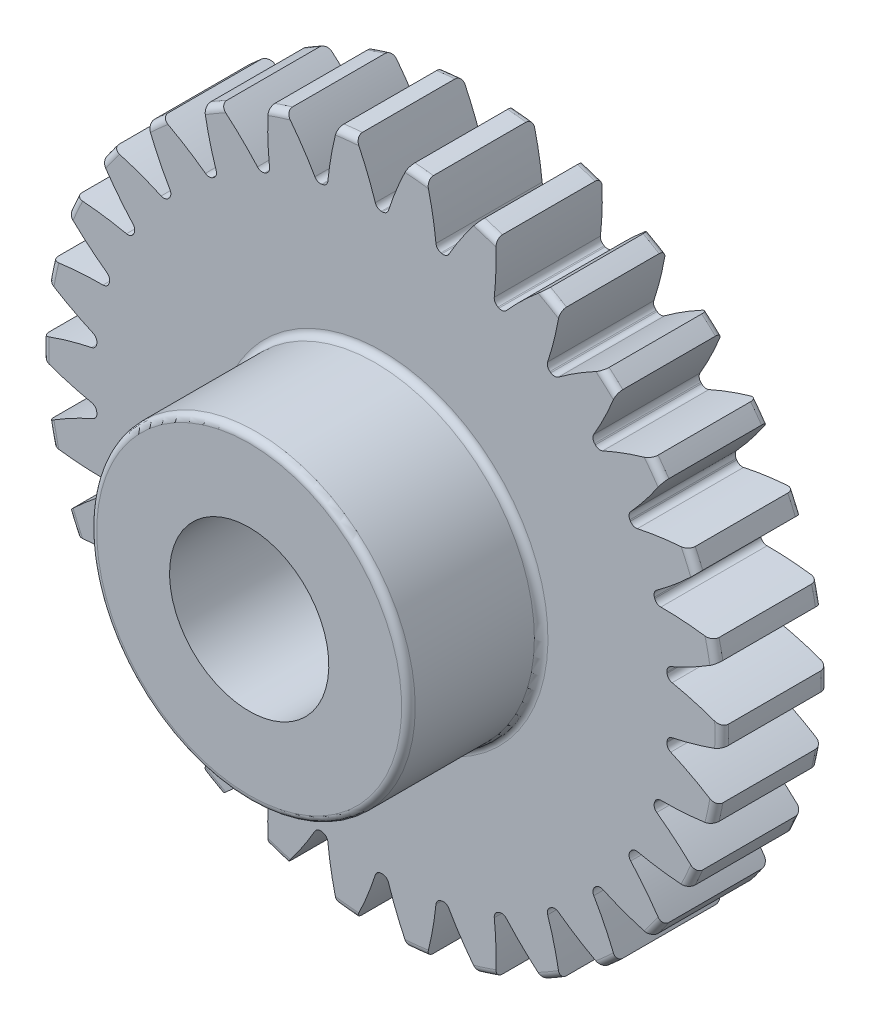
from build123d import *

# Parameters (mm, degrees)
FILLET2_R          = 0.256
CUT_EXTRUDE2_DEPTH = 19.779776425
CIRPATTERN1_COUNT  = 30


with BuildPart() as part:
    # Sketch4 → Revolve1 (revolve)
    with BuildSketch(Plane(origin=(0, 0, 0), x_dir=(0, 0, -1), z_dir=(1, 0, 0))):
        Polygon((-9, 3), (-9, 6), (-4, 6), (-4, 12.8), (0, 12.8), (0, 3), align=None)
    revolve(axis=Axis((0, 0, 4), (0, 0, 1)))

    # Fillet2
    fillet2_edges = [part.edges().sort_by_distance(p)[0] for p in [
        (0, -12.8, 0),
        (0, -12.8, 4),
        (0, -6, 4),
        (0, -6, 9),
    ]]
    fillet(fillet2_edges, radius=FILLET2_R)

    # Sketch7 → Cut-Extrude2 (cut, through all)
    with BuildSketch(Plane.XY.offset(4)):
        with BuildLine():
            ThreePointArc((-0.020673836, 10.799980213), (0, 10.8), (0.020673836, 10.799980213))
            ThreePointArc((0.020673836, 10.799980213), (0.162335885, 10.845909085), (0.249638935, 10.966556401))
            ThreePointArc((0.249638935, 10.966556401), (0.584265018, 11.879080172), (0.991642986, 12.761529853))
            ThreePointArc((0.991642986, 12.761529853), (0, 12.8), (-0.991642986, 12.761529853))
            ThreePointArc((-0.991642986, 12.761529853), (-0.584265018, 11.879080172), (-0.249638935, 10.966556401))
            ThreePointArc((-0.249638935, 10.966556401), (-0.162335885, 10.845909085), (-0.020673836, 10.799980213))
        make_face()
    cut_extrude2 = extrude(amount=-CUT_EXTRUDE2_DEPTH, mode=Mode.SUBTRACT)

    # CirPattern1: Cut-Extrude2 ×30 about axis
    cirpattern1_axis = Axis((0, 0, 0), (0, 0, 1))
    for i in range(1, CIRPATTERN1_COUNT):
        add(cut_extrude2.rotate(cirpattern1_axis, i * 360 / CIRPATTERN1_COUNT), mode=Mode.SUBTRACT)


solid = part.part
